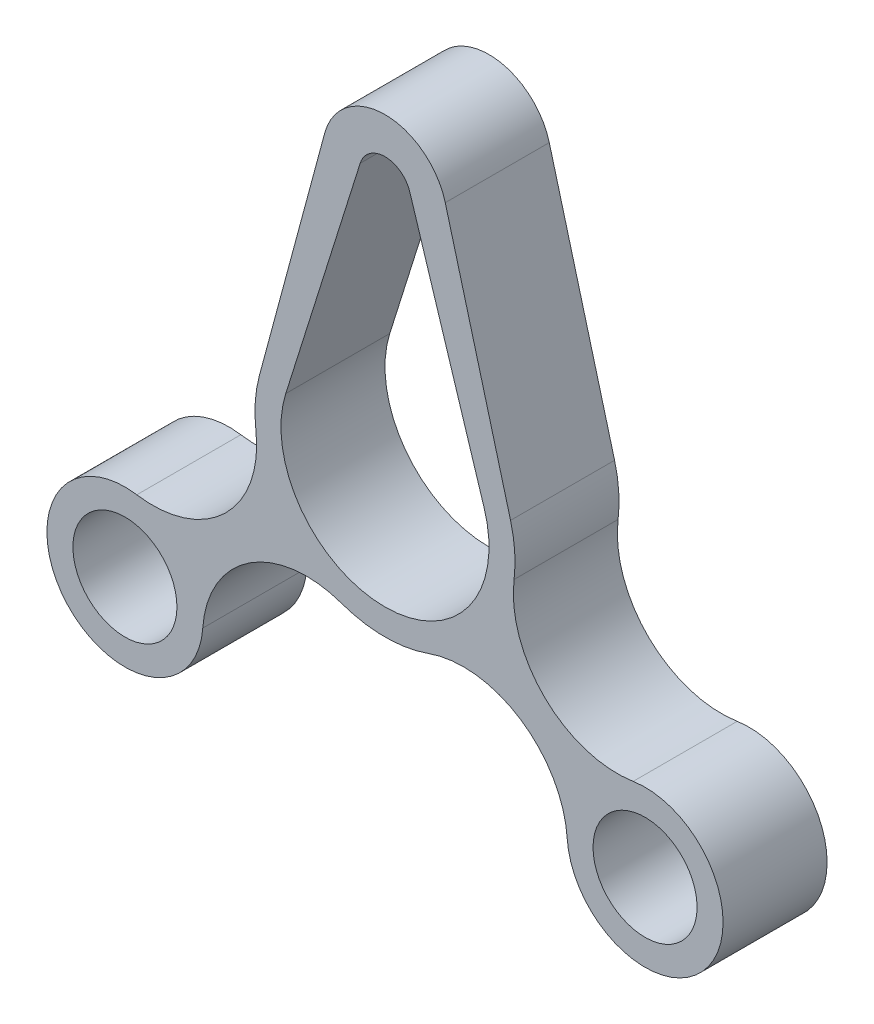
from build123d import *

# Parameters (mm, degrees)
SKETCH1_R           = 10
BOSS_EXTRUDE1_DEPTH = 10


with BuildPart() as part:
    # Sketch1 → Boss-Extrude1 (new, symmetric)
    with BuildSketch(Plane.XY):
        with BuildLine():
            Line((-24.140215409, 6.5), (-11.587303396, 53.12))
            ThreePointArc((-11.587303396, 53.12), (0, 62), (11.587303396, 53.12))
            Line((11.587303396, 53.12), (24.140215409, 6.5))
            ThreePointArc((24.140215409, 6.5), (24.936514863, 1.780512988), (24.81883517, -3.004233816))
            ThreePointArc((24.81883517, -3.004233816), (30.762049538, -19.776348187), (47.717387131, -25.174694658))
            ThreePointArc((47.717387131, -25.174694658), (61.713032142, -49.370425713), (35.03522611, -41.027395935))
            ThreePointArc((35.03522611, -41.027395935), (26.046643252, -25.670606045), (8.378996809, -23.554031767))
            ThreePointArc((8.378996809, -23.554031767), (0, -25), (-8.378996809, -23.554031767))
            ThreePointArc((-8.378996809, -23.554031767), (-26.046643252, -25.670606045), (-35.03522611, -41.027395935))
            ThreePointArc((-35.03522611, -41.027395935), (-61.713032142, -49.370425713), (-47.717387131, -25.174694658))
            ThreePointArc((-47.717387131, -25.174694658), (-30.762049538, -19.776348187), (-24.81883517, -3.004233816))
            ThreePointArc((-24.81883517, -3.004233816), (-24.936514863, 1.780512988), (-24.140215409, 6.5))
        make_face()
        with Locations((-50, -40)):
            Circle(SKETCH1_R, mode=Mode.SUBTRACT)
        with Locations(Location((50, -40, 0), (0, 0, 180))):
            Circle(SKETCH1_R, mode=Mode.SUBTRACT)
        with BuildLine():
            Line((-19.078784028, 6), (-4.769696007, 51.5))
            ThreePointArc((-4.769696007, 51.5), (0, 55), (4.769696007, 51.5))
            Line((4.769696007, 51.5), (19.078784028, 6))
            ThreePointArc((19.078784028, 6), (0, -20), (-19.078784028, 6))
        make_face(mode=Mode.SUBTRACT)
    extrude(amount=BOSS_EXTRUDE1_DEPTH, both=True)


solid = part.part
